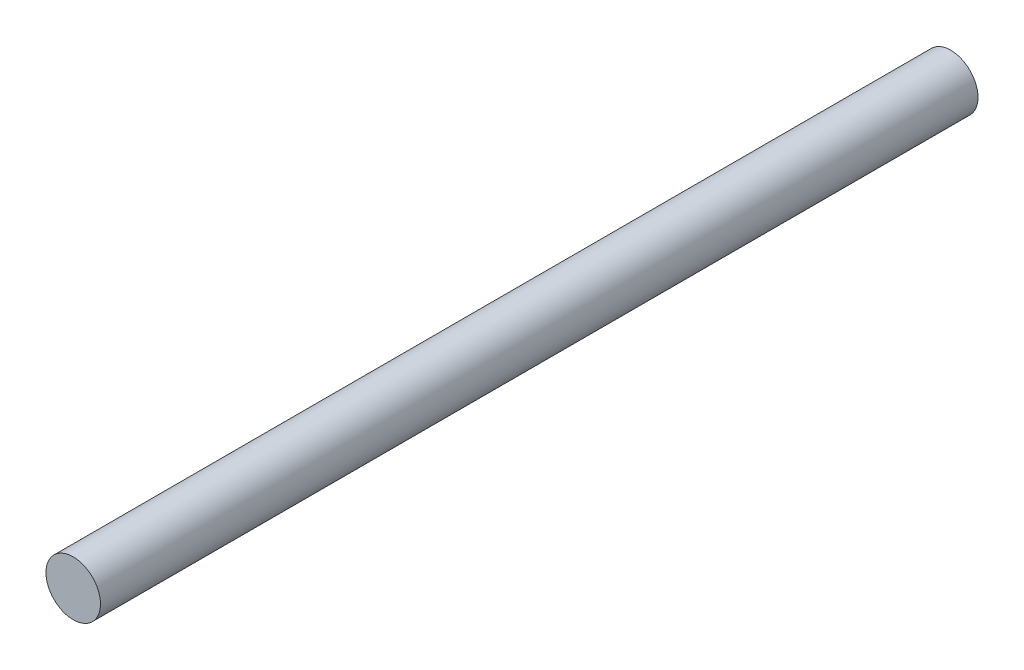
from build123d import *

# Parameters (mm, degrees)
ESQUISSE1_R        = 2.95
BOSS_EXTRU_1_DEPTH = 95


with BuildPart() as part:
    # Esquisse1 → Boss.-Extru.1 (new body)
    with BuildSketch(Plane.XY):
        Circle(ESQUISSE1_R)
    extrude(amount=BOSS_EXTRU_1_DEPTH)


solid = part.part
